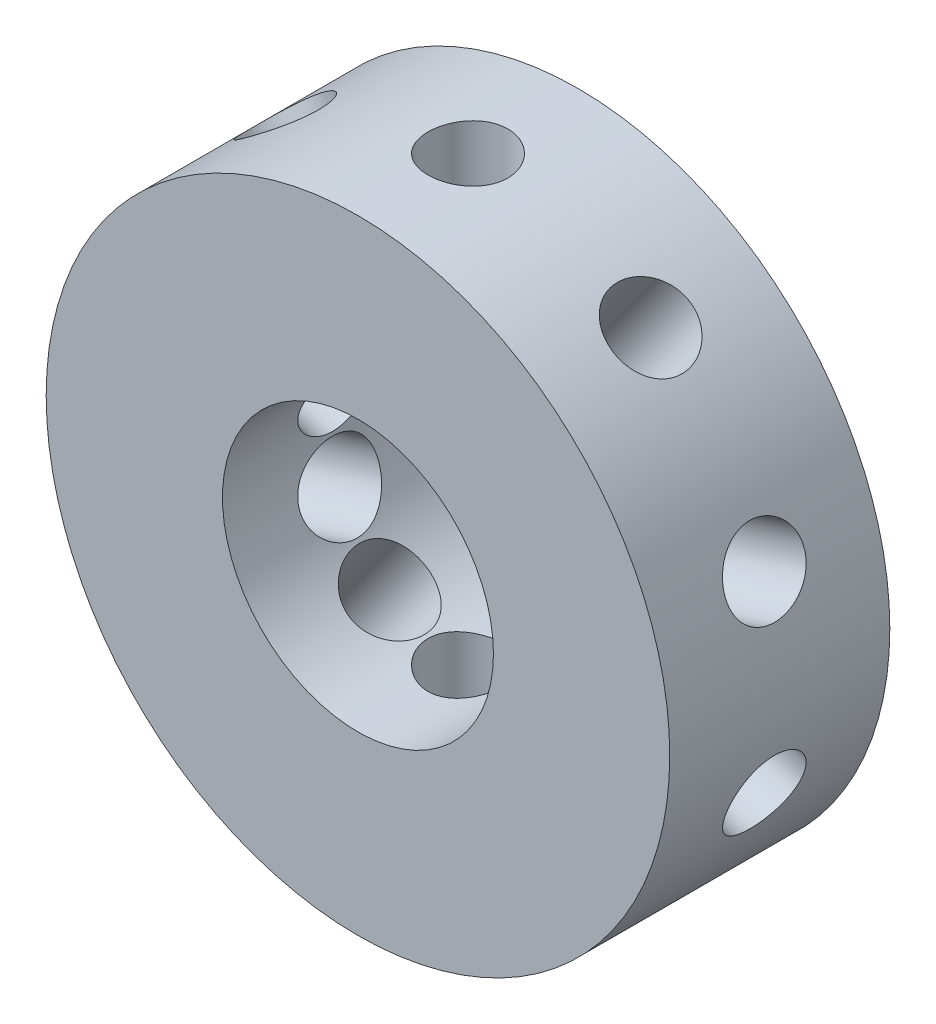
from build123d import *

# Parameters (mm, degrees)
SKETCH1_R           = 29.75
SKETCH1_R_2         = 12.928028004
BOSS_EXTRUDE1_DEPTH = 21
SKETCH3_R           = 3.81
CUT_EXTRUDE1_DEPTH  = 31
CIRPATTERN1_COUNT   = 10


with BuildPart() as part:
    # Sketch1 → Boss-Extrude1 (new body)
    with BuildSketch(Plane.XY):
        with Locations(Location((0, 0, 0), (0, 0, 180))):
            Circle(SKETCH1_R)
        with Locations(Location((0, 0, 0), (0, 0, 180))):
            Circle(SKETCH1_R_2, mode=Mode.SUBTRACT)
    extrude(amount=BOSS_EXTRUDE1_DEPTH)

    # Sketch3 → Cut-Extrude1 (cut)
    with BuildSketch(Plane(origin=(0, 0, 0), x_dir=(1, 0, 0), z_dir=(0, 1, 0))):
        with Locations(Location((0, -10.5, 0), (0, 0, 270))):
            Circle(SKETCH3_R)
    cut_extrude1 = extrude(amount=-CUT_EXTRUDE1_DEPTH, mode=Mode.SUBTRACT)

    # CirPattern1: Cut-Extrude1 ×10 about axis
    cirpattern1_axis = Axis((0, 0, 21), (0, 0, -1))
    for i in range(1, CIRPATTERN1_COUNT):
        add(cut_extrude1.rotate(cirpattern1_axis, i * 360 / CIRPATTERN1_COUNT), mode=Mode.SUBTRACT)


solid = part.part
